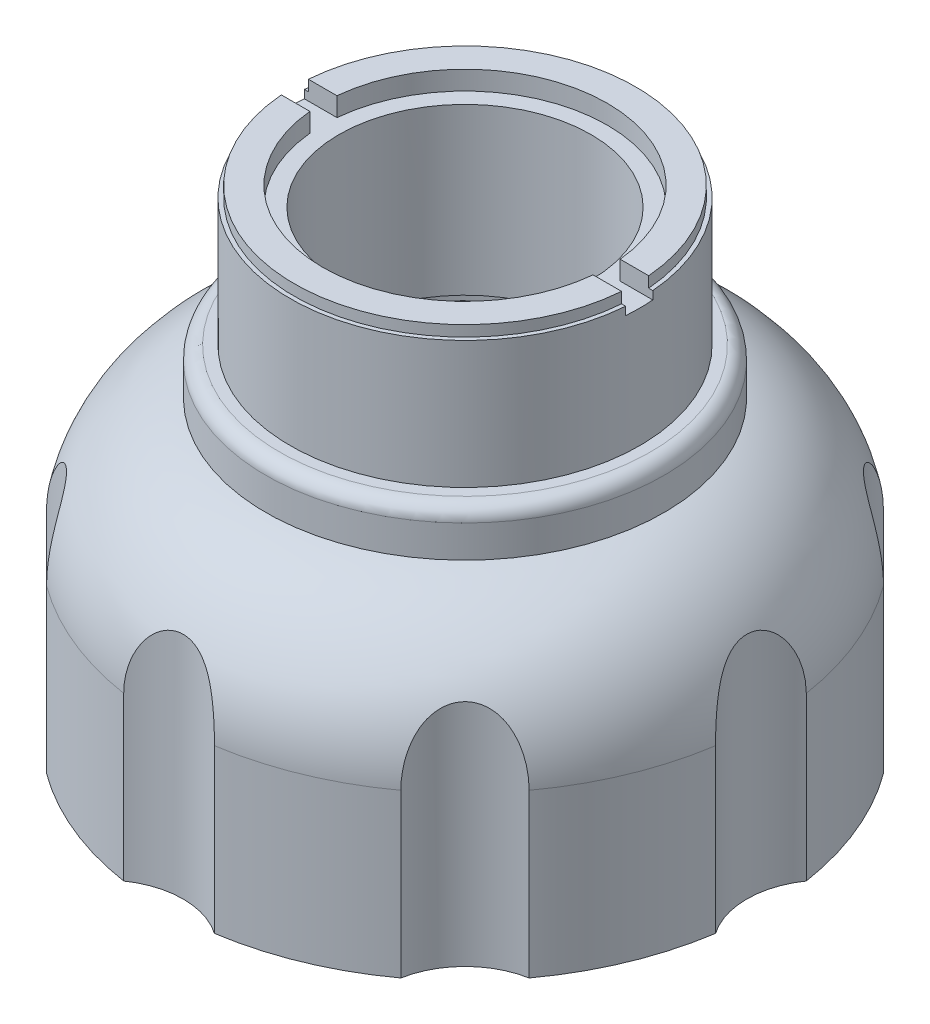
from build123d import *

# Parameters (mm, degrees)
CROQUIS1_R              = 11.05
SALIENTE_EXTRUIR2_DEPTH = 6
CROQUIS3_R              = 9.7
CORTAR_EXTRUIR2_DEPTH   = 6
CROQUIS7_R              = 2.94693617
CROQUIS7_R_2            = 2.946936168
CORTAR_EXTRUIR3_DEPTH   = 10.56
CROQUIS8_W              = 2.7
CROQUIS8_H              = 1.7
REDONDEO1_R             = 0.5
CROQUIS9_W              = 1.8
CROQUIS9_H              = 5.1
CORTAR_EXTRUIR7_START   = -0.4
CROQUIS14_R             = 6.45
CROQUIS14_R_2           = 6.3
CORTAR_EXTRUIR7_DEPTH   = 0.4
CORTAR_EXTRUIR8_DEPTH   = 0.7


with BuildPart() as part:
    # Croquis1 → Saliente-Extruir2 (new body)
    with BuildSketch(Plane(origin=(0, 0, 0), x_dir=(1, 0, 0), z_dir=(0, 1, 0))):
        with Locations(Location((0, 0, 0), (0, 0, 270))):
            Circle(CROQUIS1_R)
    extrude(amount=SALIENTE_EXTRUIR2_DEPTH)

    # Croquis3 → Cortar-Extruir2 (cut)
    with BuildSketch(Plane(origin=(0, 6, 0), x_dir=(1, 0, 0), z_dir=(0, 1, 0))):
        with Locations(Location((0, 0, 0), (0, 0, 270))):
            Circle(CROQUIS3_R)
    extrude(amount=-CORTAR_EXTRUIR2_DEPTH, mode=Mode.SUBTRACT)

    # Croquis4 → Revolución1 (revolve)
    with BuildSketch(Plane.XY, mode=Mode.PRIVATE) as revoluci_n1_sk:
        with BuildLine():
            Line((6.05, 9.65), (6.05, 11))
            ThreePointArc((6.05, 11), (9.585533906, 9.535533906), (11.05, 6))
            Line((11.05, 6), (9.7, 6))
            ThreePointArc((9.7, 6), (8.630939751, 8.580939751), (6.05, 9.65))
        make_face()
    revolve(revoluci_n1_sk.sketch.rotate(Axis((0, 0, 0), (0, 1, 0)), 90), axis=Axis((0, 0, 0), (0, 1, 0)))

    # Croquis7 → Cortar-Extruir3 (cut)
    with BuildSketch(Plane.XZ):
        with Locations((0, 13.34693617)):
            Circle(CROQUIS7_R)
        with Locations((-9.437709072, 9.437709072)):
            Circle(CROQUIS7_R_2)
        with Locations((9.437709074, 9.437709074)):
            Circle(CROQUIS7_R)
        with Locations((13.34693617, 0)):
            Circle(CROQUIS7_R)
        with Locations((9.437709074, -9.437709074)):
            Circle(CROQUIS7_R)
        with Locations((0, -13.34693617)):
            Circle(CROQUIS7_R)
        with Locations((-9.437709074, -9.437709074)):
            Circle(CROQUIS7_R)
        with Locations((-13.34693617, 0)):
            Circle(CROQUIS7_R)
    extrude(amount=-CORTAR_EXTRUIR3_DEPTH, mode=Mode.SUBTRACT)

    # Croquis8 → Revolución2 (revolve)
    with BuildSketch(Plane.XY, mode=Mode.PRIVATE) as revoluci_n2_sk:
        with Locations((-6, 11.665880959)):
            Rectangle(CROQUIS8_W, CROQUIS8_H)
    revolve(revoluci_n2_sk.sketch.rotate(Axis((0, 0, 0), (0, 1, 0)), 270), axis=Axis((0, 0, 0), (0, 1, 0)))

    # Redondeo1
    redondeo1_edges = [part.edges().sort_by_distance(p)[0] for p in [
        (0, 12.515880959, 7.35),
    ]]
    fillet(redondeo1_edges, radius=REDONDEO1_R)

    # Croquis9 → Revolución3 (revolve)
    with BuildSketch(Plane.XY, mode=Mode.PRIVATE) as revoluci_n3_sk:
        with Locations((-5.55, 15.065880959)):
            Rectangle(CROQUIS9_W, CROQUIS9_H)
    revolve(revoluci_n3_sk.sketch.rotate(Axis((0, 0, 0), (0, 1, 0)), 270), axis=Axis((0, 0, 0), (0, 1, 0)))

    # Croquis14 → Cortar-Extruir7 (cut)
    with BuildSketch(Plane(origin=(0, 17.615880959, 0), x_dir=(1, 0, 0), z_dir=(0, 1, 0)).offset(CORTAR_EXTRUIR7_START)):
        with Locations(Location((0, 0, 0), (0, 0, 90))):
            Circle(CROQUIS14_R)
        with Locations(Location((0, 0, 0), (0, 0, 270))):
            Circle(CROQUIS14_R_2, mode=Mode.SUBTRACT)
    extrude(amount=CORTAR_EXTRUIR7_DEPTH, mode=Mode.SUBTRACT)

    # Croquis10 → Cortar-Extruir8 (cut)
    with BuildSketch(Plane(origin=(0, 17.615880959, 0), x_dir=(1, 0, 0), z_dir=(0, 1, 0))):
        with BuildLine():
            Line((-6.45, -0.5), (-5.22613624, -0.5))
            ThreePointArc((-5.22613624, -0.5), (0, -5.25), (5.22613624, -0.5))
            Line((5.22613624, -0.5), (6.45, -0.5))
            Line((6.45, -0.5), (6.45, 0.5))
            Line((6.45, 0.5), (5.22613624, 0.5))
            ThreePointArc((5.22613624, 0.5), (0, 5.25), (-5.22613624, 0.5))
            Line((-5.22613624, 0.5), (-6.45, 0.5))
            Line((-6.45, 0.5), (-6.45, -0.5))
        make_face()
    extrude(amount=-CORTAR_EXTRUIR8_DEPTH, mode=Mode.SUBTRACT)


solid = part.part
